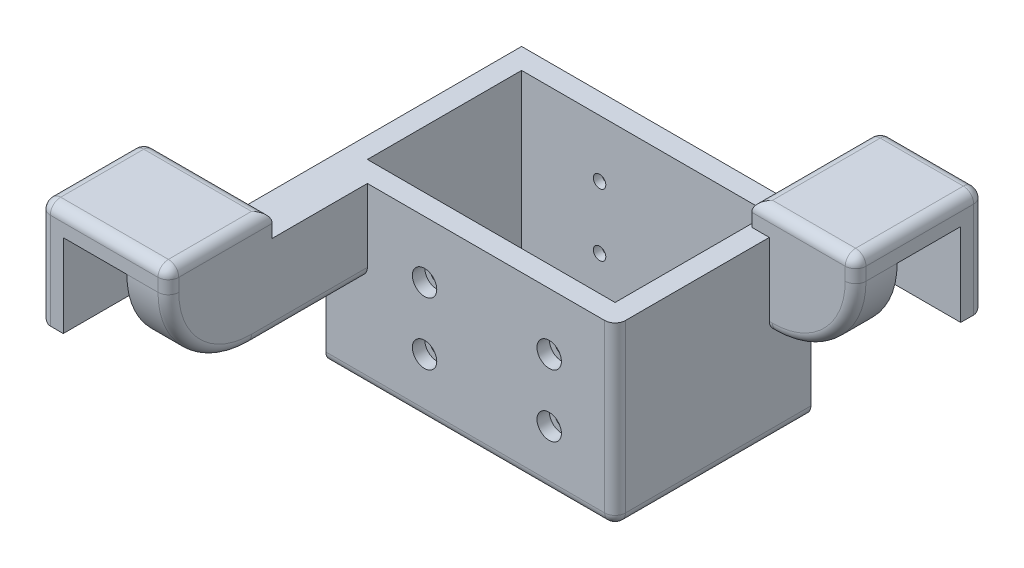
from build123d import *

# Parameters (mm, degrees)
SKETCH23_W           = 55.7
SKETCH23_H           = 37.7
SKETCH23_W_2         = 47.7
SKETCH23_H_2         = 29.7
BOSS_EXTRUDE11_DEPTH = 34.1
BOSS_EXTRUDE3_DEPTH  = 4.5
SKETCH19_W           = 4.5
SKETCH19_H           = 20
SKETCH19_W_2         = 20
SKETCH19_H_2         = 4.5
SKETCH19_W_3         = 8
SKETCH19_H_3         = 38.319745762
SKETCH19_W_4         = 16.618093031
SKETCH19_H_4         = 8
BOSS_EXTRUDE10_DEPTH = 16
FILLET6_R            = 16
FILLET7_R            = 2
SKETCH11_R           = 1.2
CUT_EXTRUDE1_DEPTH   = 111.325510764
SKETCH21_R           = 2.35
CUT_EXTRUDE2_DEPTH   = 2.4
SKETCH22_R           = 2.35
CUT_EXTRUDE3_DEPTH   = 2.4


with BuildPart() as part:
    # Sketch23 → Boss-Extrude11 (new body)
    with BuildSketch(Plane(origin=(0, 0, 0), x_dir=(1, 0, 0), z_dir=(0, 1, 0))):
        with Locations((27.85, -18.85)):
            Rectangle(SKETCH23_W, SKETCH23_H)
        with Locations((27.85, -18.85)):
            Rectangle(SKETCH23_W_2, SKETCH23_H_2, mode=Mode.SUBTRACT)
    extrude(amount=-BOSS_EXTRUDE11_DEPTH)

    # Sketch12 → Boss-Extrude3 (add)
    with BuildSketch(Plane(origin=(0, 0, 0), x_dir=(1, 0, 0), z_dir=(0, 1, 0))):
        Polygon((0, -76.019745762), (-12.2428, -76.019745762), (-16.7428, -76.019745762), (-16.7428, -56.019745762), (-12.2428, -56.019745762), (0, -56.019745762), (8, -56.019745762), (8, -76.019745762), align=None)
        Polygon((52.318093031, -8), (52.318093031, 0), (52.318093031, 12.2428), (52.318093031, 16.7428), (72.318093031, 16.7428), (72.318093031, 12.2428), (72.318093031, 0), (72.318093031, -8), align=None)
    extrude(amount=BOSS_EXTRUDE3_DEPTH)


with BuildPart() as boss_extrude3_piece_1:
    # of the separate pieces the step leaves, piece 1, a body of its own (boss_extrude3_pieces)
    add(part.part.solids().sort_by_distance((0, 0, 0))[0])



with BuildPart() as boss_extrude3_piece_2:
    # of the separate pieces the step leaves, piece 2, a body of its own (boss_extrude3_pieces)
    add(part.part.solids().sort_by_distance((8, 0, 76.019745762))[0])


with BuildPart() as boss_extrude3_piece_1_1:
    add(boss_extrude3_piece_1.part)

    add(boss_extrude3_piece_2.part)  # Boss-Extrude10 merges Boss-Extrude3 piece 2
    # Sketch19 → Boss-Extrude10 (add)
    with BuildSketch(Plane(origin=(0, 0, 0), x_dir=(1, 0, 0), z_dir=(0, 1, 0))):
        with Locations((-14.4928, -66.019745762)):
            Rectangle(SKETCH19_W, SKETCH19_H)
        with Locations((62.318093031, 14.4928)):
            Rectangle(SKETCH19_W_2, SKETCH19_H_2)
        with Locations((4, -56.859872881)):
            Rectangle(SKETCH19_W_3, SKETCH19_H_3)
        with Locations((64.009046516, -4)):
            Rectangle(SKETCH19_W_4, SKETCH19_H_4)
    extrude(amount=-BOSS_EXTRUDE10_DEPTH)

    # Fillet6
    fillet6_edges = [boss_extrude3_piece_1_1.edges().sort_by_distance(p)[0] for p in [
        (72.318093031, -16, 4),
        (4, -16, 76.019745762),
    ]]
    fillet(fillet6_edges, radius=FILLET6_R)

    # Fillet7
    fillet7_edges = [boss_extrude3_piece_1_1.edges().sort_by_distance(p)[0] for p in [
        (67.63180153, -11.313708499, 8),
        (8, 2.25, 76.019745762),
        (8, -16, 48.859872881),
        (8, -11.313708499, 71.333454261),
        (55.7, -34.1, 18.85),
        (72.318093031, 2.25, 8),
        (72.318093031, -5.75, -16.7428),
        (52.318093031, -5.75, -16.7428),
        (62.318093031, 4.5, 8),
        (72.318093031, 4.5, -4.3714),
        (62.318093031, 4.5, -16.7428),
        (52.318093031, 4.5, -4.3714),
        (-16.7428, -5.75, 56.019745762),
        (-16.7428, -5.75, 76.019745762),
        (8, 4.5, 66.019745762),
        (-4.3714, 4.5, 56.019745762),
        (-16.7428, 4.5, 66.019745762),
        (-4.3714, 4.5, 76.019745762),
        (56.009046515, -16, 8),
        (-16.7428, -16, 66.019745762),
        (55.7, -17.05, 37.7),
        (27.85, -34.1, 37.7),
        (62.318093031, -16, -16.7428),
    ]]
    fillet(fillet7_edges, radius=FILLET7_R)

    # Sketch11 → Cut-Extrude1 (cut, through all)
    with BuildSketch(Plane(origin=(0, 0, 0), x_dir=(-1, 0, 0), z_dir=(0, 0, -1))):
        with Locations(Location((-19.011079079, -11, 0), (0, 0, 180))):
            Circle(SKETCH11_R)
        with Locations(Location((-19.011079079, -23, 0), (0, 0, 180))):
            Circle(SKETCH11_R)
        with Locations(Location((-43.01107908, -11, 0), (0, 0, 180))):
            Circle(SKETCH11_R)
        with Locations(Location((-43.011079079, -23, 0), (0, 0, 180))):
            Circle(SKETCH11_R)
    extrude(amount=-CUT_EXTRUDE1_DEPTH, mode=Mode.SUBTRACT)

    # Sketch21 → Cut-Extrude2 (cut)
    with BuildSketch(Plane.XY.offset(37.7)):
        with Locations((19.011079079, -11)):
            Circle(SKETCH21_R)
        with Locations((43.01107908, -11)):
            Circle(SKETCH21_R)
        with Locations((19.011079079, -23)):
            Circle(SKETCH21_R)
        with Locations((43.011079079, -23)):
            Circle(SKETCH21_R)
    extrude(amount=-CUT_EXTRUDE2_DEPTH, mode=Mode.SUBTRACT)

    # Sketch22 → Cut-Extrude3 (cut)
    with BuildSketch(Plane(origin=(0, 0, 0), x_dir=(-1, 0, 0), z_dir=(0, 0, -1))):
        with Locations(Location((-43.01107908, -11, 0), (0, 0, 180))):
            Circle(SKETCH22_R)
        with Locations(Location((-43.011079079, -23, 0), (0, 0, 180))):
            Circle(SKETCH22_R)
        with Locations(Location((-19.011079079, -11, 0), (0, 0, 180))):
            Circle(SKETCH22_R)
        with Locations(Location((-19.011079079, -23, 0), (0, 0, 180))):
            Circle(SKETCH22_R)
    extrude(amount=-CUT_EXTRUDE3_DEPTH, mode=Mode.SUBTRACT)


solid = boss_extrude3_piece_1_1.part
